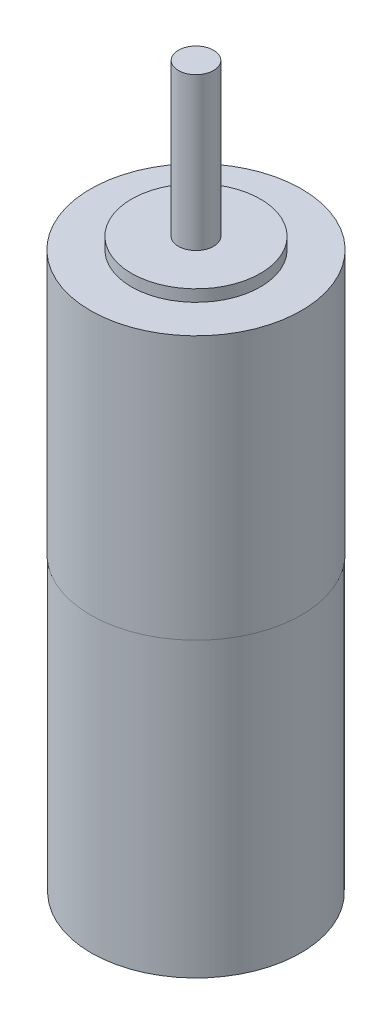
from build123d import *

# Parameters (mm, degrees)
SKETCH_1_R      = 17.9
EXTRUDE_1_DEPTH = 50
SKETCH_3_R      = 18
EXTRUDE_2_DEPTH = 45
SKETCH_4_R      = 11
EXTRUDE_3_DEPTH = 2
SKETCH_5_R      = 3
EXTRUDE_4_DEPTH = 26


with BuildPart() as part:
    # 草图1 → 凸台-拉伸1 (new body)
    with BuildSketch(Plane(origin=(0, 0, 0), x_dir=(1, 0, 0), z_dir=(0, 1, 0))):
        with Locations(Location((0, 0, 0), (0, 0, 270))):
            Circle(SKETCH_1_R)
    extrude(amount=EXTRUDE_1_DEPTH)

    # 草图3 → 凸台-拉伸2 (add)
    with BuildSketch(Plane(origin=(0, 50, 0), x_dir=(1, 0, 0), z_dir=(0, 1, 0))):
        with Locations(Location((0, 0, 0), (0, 0, 90))):
            Circle(SKETCH_3_R)
    extrude(amount=EXTRUDE_2_DEPTH)

    # 草图4 → 凸台-拉伸3 (add)
    with BuildSketch(Plane(origin=(0, 95, 0), x_dir=(1, 0, 0), z_dir=(0, 1, 0))):
        with Locations(Location((0, 0, 0), (0, 0, 270))):
            Circle(SKETCH_4_R)
    extrude(amount=EXTRUDE_3_DEPTH)

    # 草图5 → 凸台-拉伸4 (add)
    with BuildSketch(Plane(origin=(0, 97, 0), x_dir=(1, 0, 0), z_dir=(0, 1, 0))):
        with Locations(Location((0, 0, 0), (0, 0, 90))):
            Circle(SKETCH_5_R)
    extrude(amount=EXTRUDE_4_DEPTH)


solid = part.part
